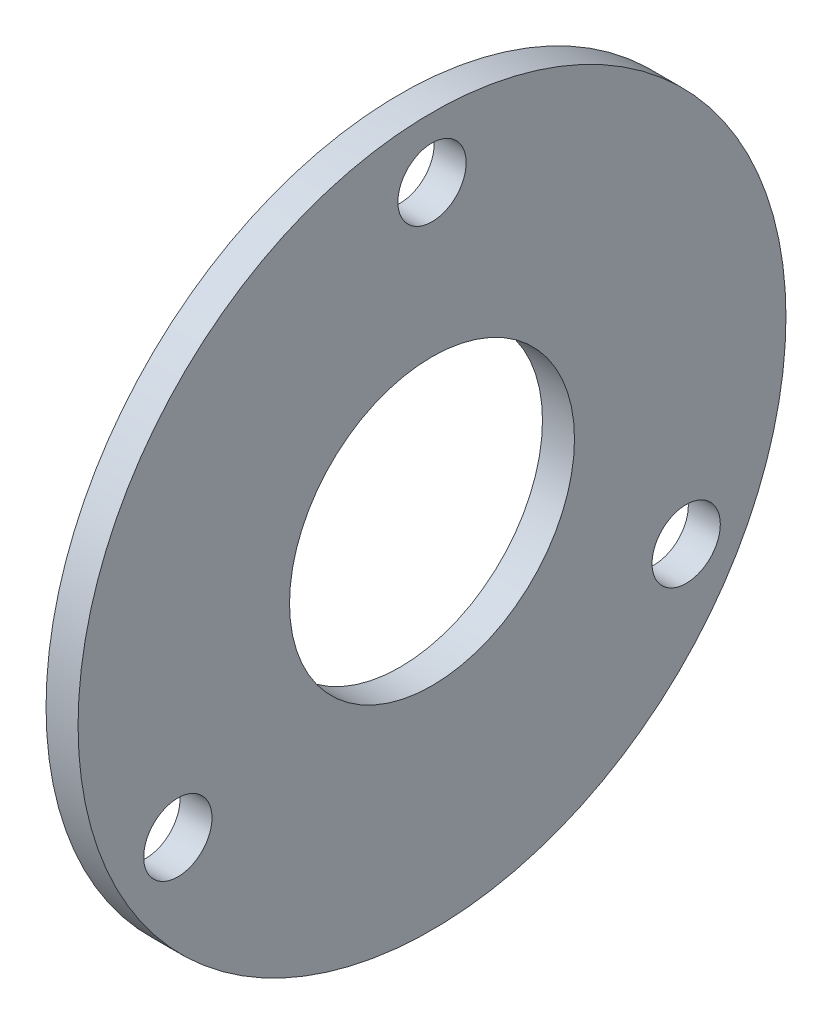
from build123d import *

# Parameters (mm, degrees)
SZKIC1_W                   = 3
SZKIC1_H                   = 19.815
SZKIC2_R                   = 3.2
WYTNIJ_WYCI_GNI_CIE1_DEPTH = 47.999650126


with BuildPart() as part:
    # Szkic1 → Obrót2 (revolve)
    with BuildSketch(Plane.XY, mode=Mode.PRIVATE) as obr_t2_sk:
        with Locations((-30.002520162, 23.2585)):
            Rectangle(SZKIC1_W, SZKIC1_H)
    revolve(obr_t2_sk.sketch.rotate(Axis((0, 0, 0), (-1, 0, 0)), 90), axis=Axis((0, 0, 0), (-1, 0, 0)))

    # Szkic2 → Wytnij-wyciągnięcie1 (cut, through all)
    with BuildSketch(Plane(origin=(-28.502520162, 0, 0), x_dir=(0, 0, -1), z_dir=(1, 0, 0))):
        with Locations((0, 27.5)):
            Circle(SZKIC2_R)
        with Locations((23.815698604, -13.75)):
            Circle(SZKIC2_R)
        with Locations((-23.815698604, -13.75)):
            Circle(SZKIC2_R)
    extrude(amount=-WYTNIJ_WYCI_GNI_CIE1_DEPTH, mode=Mode.SUBTRACT)


solid = part.part
